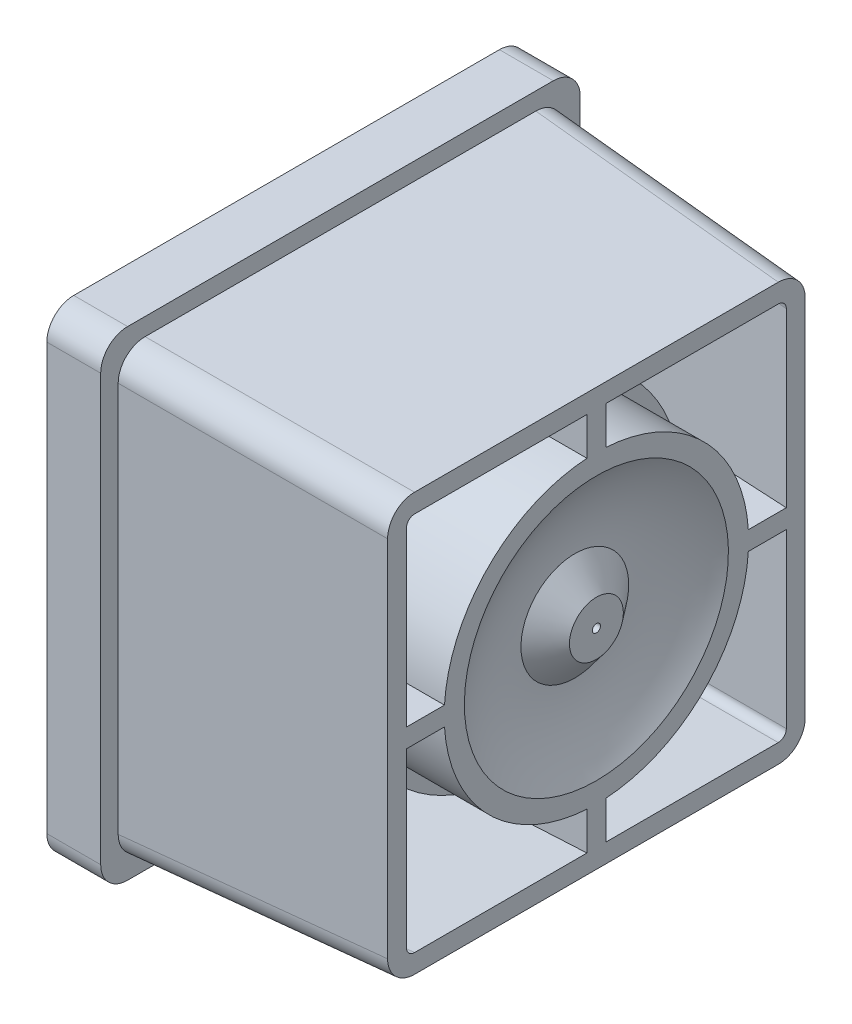
from build123d import *

# Parameters (mm, degrees)
FILLET1_R           = 1
SHELL1_T            = -0.7
SKETCH3_W           = 17.8
SKETCH3_H           = 17.8
BOSS_EXTRUDE1_DEPTH = 2
FILLET2_R           = 1
BOSS_EXTRUDE2_REACH = 17.769
FILLET3_R           = 0.5
SKETCH7_R           = 0.75
SKETCH7_R_2         = 0.5
CUT_EXTRUDE1_DEPTH  = 0.5


with BuildPart() as part:
    # Sketch2 → Loft1 section 0
    with BuildSketch(Plane(origin=(9.5, 0, 0), x_dir=(0, 0, -1), z_dir=(1, 0, 0))):
        with BuildLine():
            Line((7.75, -7.75), (-7.75, -7.75))
            Line((-7.75, -7.75), (-7.75, 7.75))
            Line((-7.75, 7.75), (7.75, 7.75))
            Line((7.75, 7.75), (7.75, -7.75))
        make_face()
    # Sketch1 → Loft1 section 1
    with BuildSketch(Plane(origin=(0, 0, 0), x_dir=(0, 0, -1), z_dir=(1, 0, 0))):
        with BuildLine():
            Line((8.25, -8.25), (-8.25, -8.25))
            Line((-8.25, -8.25), (-8.25, 8.25))
            Line((-8.25, 8.25), (8.25, 8.25))
            Line((8.25, 8.25), (8.25, -8.25))
        make_face()
    loft()

    # Fillet1
    fillet1_edges = [part.edges().sort_by_distance(p)[0] for p in [
        (4.75, -8, -8),
        (4.75, -8, 8),
        (4.75, 8, -8),
        (4.75, 8, 8),
    ]]
    fillet(fillet1_edges, radius=FILLET1_R)

    # Shell1
    shell1_openings = [part.faces().sort_by_distance(p)[0] for p in [
        (0, 0, 0),
        (9.5, 0, 0),
    ]]
    offset(amount=SHELL1_T, openings=shell1_openings)

    # Sketch3 → Boss-Extrude1 (add)
    with BuildSketch(Plane(origin=(0, 0, 0), x_dir=(0, 0, -1), z_dir=(1, 0, 0))):
        Rectangle(SKETCH3_W, SKETCH3_H)
    extrude(amount=-BOSS_EXTRUDE1_DEPTH)

    # Fillet2
    fillet2_edges = [part.edges().sort_by_distance(p)[0] for p in [
        (-1, 8.9, -8.9),
        (-1, -8.9, -8.9),
        (-1, -8.9, 8.9),
        (-1, 8.9, 8.9),
    ]]
    fillet(fillet2_edges, radius=FILLET2_R)

    # Sketch5 → Revolve1 (revolve)
    with BuildSketch(Plane.XY, mode=Mode.PRIVATE) as revolve1_sk:
        with BuildLine():
            Line((0, 0), (0, 6.15))
            Line((0, 6.15), (6.5, 6.15))
            Line((6.5, 6.15), (6.5, 5.65))
            Line((6.5, 5.65), (9.5, 5.65))
            Line((9.5, 5.65), (9.5, 4.9))
            ThreePointArc((9.5, 4.9), (8.903666753, 3.504160896), (8.7, 2))
            Line((8.7, 2), (9.5, 1))
            Line((9.5, 1), (9.5, 0))
            Line((9.5, 0), (0, 0))
        make_face()
    revolve(revolve1_sk.sketch.rotate(Axis((0, 0, 0), (1, 0, 0)), 180), axis=Axis((0, 0, 0), (1, 0, 0)))

    # Boss-Extrude2: up to this face of the body (flat: up to its plane)
    boss_extrude2_end = Plane(part.part.faces().sort_by_distance((9.5, 0, 0))[0])
    # Sketch10 → Boss-Extrude2 (add, up to the picked face)
    with BuildSketch(Plane(origin=(0, 0, 0), x_dir=(0, 0, -1), z_dir=(1, 0, 0)), mode=Mode.PRIVATE) as boss_extrude2_sk1:
        with BuildLine():
            Line((-0.35, 7.549031141), (-0.35, 6.140032573))
            ThreePointArc((-0.35, 6.140032573), (0, 6.15), (0.35, 6.140032573))
            Line((0.35, 6.140032573), (0.35, 7.549031141))
            Line((0.35, 7.549031141), (-0.35, 7.549031141))
        make_face()
    boss_extrude2_tool1 = split(extrude(boss_extrude2_sk1.sketch, amount=BOSS_EXTRUDE2_REACH, mode=Mode.PRIVATE), bisect_by=boss_extrude2_end, keep=Keep.BOTH, mode=Mode.PRIVATE)
    # Sketch10 → Boss-Extrude2 (add, up to the picked face)
    with BuildSketch(Plane(origin=(0, 0, 0), x_dir=(0, 0, -1), z_dir=(1, 0, 0)), mode=Mode.PRIVATE) as boss_extrude2_sk2:
        with BuildLine():
            ThreePointArc((0.35, 6.140032573), (0, 6.15), (-0.35, 6.140032573))
            Line((-0.35, 6.140032573), (-0.35, 5.639148872))
            ThreePointArc((-0.35, 5.639148872), (0, 5.65), (0.35, 5.639148872))
            Line((0.35, 5.639148872), (0.35, 6.140032573))
        make_face()
    boss_extrude2_tool2 = split(extrude(boss_extrude2_sk2.sketch, amount=BOSS_EXTRUDE2_REACH, mode=Mode.PRIVATE), bisect_by=boss_extrude2_end, keep=Keep.BOTH, mode=Mode.PRIVATE)
    # Sketch10 → Boss-Extrude2 (add, up to the picked face)
    with BuildSketch(Plane(origin=(0, 0, 0), x_dir=(0, 0, -1), z_dir=(1, 0, 0)), mode=Mode.PRIVATE) as boss_extrude2_sk3:
        with BuildLine():
            Line((-0.35, -5.639148872), (-0.35, -6.140032573))
            ThreePointArc((-0.35, -6.140032573), (0, -6.15), (0.35, -6.140032573))
            Line((0.35, -6.140032573), (0.35, -5.639148872))
            ThreePointArc((0.35, -5.639148872), (0, -5.65), (-0.35, -5.639148872))
        make_face()
    boss_extrude2_tool3 = split(extrude(boss_extrude2_sk3.sketch, amount=BOSS_EXTRUDE2_REACH, mode=Mode.PRIVATE), bisect_by=boss_extrude2_end, keep=Keep.BOTH, mode=Mode.PRIVATE)
    # Sketch10 → Boss-Extrude2 (add, up to the picked face)
    with BuildSketch(Plane(origin=(0, 0, 0), x_dir=(0, 0, -1), z_dir=(1, 0, 0)), mode=Mode.PRIVATE) as boss_extrude2_sk4:
        with BuildLine():
            Line((7.549031141, 0.35), (6.140032573, 0.35))
            ThreePointArc((6.140032573, 0.35), (6.147507638, 0.17507095), (6.15, 0))
            ThreePointArc((6.15, 0), (6.147507638, -0.17507095), (6.140032573, -0.35))
            Line((6.140032573, -0.35), (7.549031141, -0.35))
            Line((7.549031141, -0.35), (7.549031141, 0.35))
        make_face()
    boss_extrude2_tool4 = split(extrude(boss_extrude2_sk4.sketch, amount=BOSS_EXTRUDE2_REACH, mode=Mode.PRIVATE), bisect_by=boss_extrude2_end, keep=Keep.BOTH, mode=Mode.PRIVATE)
    # Sketch10 → Boss-Extrude2 (add, up to the picked face)
    with BuildSketch(Plane(origin=(0, 0, 0), x_dir=(0, 0, -1), z_dir=(1, 0, 0)), mode=Mode.PRIVATE) as boss_extrude2_sk5:
        with BuildLine():
            Line((-5.639148872, 0.35), (-6.140032573, 0.35))
            ThreePointArc((-6.140032573, 0.35), (-6.15, 0), (-6.140032573, -0.35))
            Line((-6.140032573, -0.35), (-5.639148872, -0.35))
            ThreePointArc((-5.639148872, -0.35), (-5.65, 0), (-5.639148872, 0.35))
        make_face()
    boss_extrude2_tool5 = split(extrude(boss_extrude2_sk5.sketch, amount=BOSS_EXTRUDE2_REACH, mode=Mode.PRIVATE), bisect_by=boss_extrude2_end, keep=Keep.BOTH, mode=Mode.PRIVATE)
    # Sketch10 → Boss-Extrude2 (add, up to the picked face)
    with BuildSketch(Plane(origin=(0, 0, 0), x_dir=(0, 0, -1), z_dir=(1, 0, 0)), mode=Mode.PRIVATE) as boss_extrude2_sk6:
        with BuildLine():
            ThreePointArc((6.15, 0), (6.147507638, 0.17507095), (6.140032573, 0.35))
            Line((6.140032573, 0.35), (5.639148872, 0.35))
            ThreePointArc((5.639148872, 0.35), (5.647286566, 0.175084085), (5.65, 0))
            ThreePointArc((5.65, 0), (5.647286566, -0.175084085), (5.639148872, -0.35))
            Line((5.639148872, -0.35), (6.140032573, -0.35))
            ThreePointArc((6.140032573, -0.35), (6.147507638, -0.17507095), (6.15, 0))
        make_face()
    boss_extrude2_tool6 = split(extrude(boss_extrude2_sk6.sketch, amount=BOSS_EXTRUDE2_REACH, mode=Mode.PRIVATE), bisect_by=boss_extrude2_end, keep=Keep.BOTH, mode=Mode.PRIVATE)
    # Sketch10 → Boss-Extrude2 (add, up to the picked face)
    with BuildSketch(Plane(origin=(0, 0, 0), x_dir=(0, 0, -1), z_dir=(1, 0, 0)), mode=Mode.PRIVATE) as boss_extrude2_sk7:
        with BuildLine():
            ThreePointArc((0.35, -6.140032573), (0, -6.15), (-0.35, -6.140032573))
            Line((-0.35, -6.140032573), (-0.35, -7.549031141))
            Line((-0.35, -7.549031141), (0.35, -7.549031141))
            Line((0.35, -7.549031141), (0.35, -6.140032573))
        make_face()
    boss_extrude2_tool7 = split(extrude(boss_extrude2_sk7.sketch, amount=BOSS_EXTRUDE2_REACH, mode=Mode.PRIVATE), bisect_by=boss_extrude2_end, keep=Keep.BOTH, mode=Mode.PRIVATE)
    # Sketch10 → Boss-Extrude2 (add, up to the picked face)
    with BuildSketch(Plane(origin=(0, 0, 0), x_dir=(0, 0, -1), z_dir=(1, 0, 0)), mode=Mode.PRIVATE) as boss_extrude2_sk8:
        with BuildLine():
            ThreePointArc((0.35, 6.140032573), (0, 6.15), (-0.35, 6.140032573))
            Line((-0.35, 6.140032573), (-0.35, 5.639148872))
            ThreePointArc((-0.35, 5.639148872), (0, 5.65), (0.35, 5.639148872))
            Line((0.35, 5.639148872), (0.35, 6.140032573))
        make_face()
    boss_extrude2_tool8 = split(extrude(boss_extrude2_sk8.sketch, amount=BOSS_EXTRUDE2_REACH, mode=Mode.PRIVATE), bisect_by=boss_extrude2_end, keep=Keep.BOTH, mode=Mode.PRIVATE)
    # Sketch10 → Boss-Extrude2 (add, up to the picked face)
    with BuildSketch(Plane(origin=(0, 0, 0), x_dir=(0, 0, -1), z_dir=(1, 0, 0)), mode=Mode.PRIVATE) as boss_extrude2_sk9:
        with BuildLine():
            Line((-0.35, -5.639148872), (-0.35, -6.140032573))
            ThreePointArc((-0.35, -6.140032573), (0, -6.15), (0.35, -6.140032573))
            Line((0.35, -6.140032573), (0.35, -5.639148872))
            ThreePointArc((0.35, -5.639148872), (0, -5.65), (-0.35, -5.639148872))
        make_face()
    boss_extrude2_tool9 = split(extrude(boss_extrude2_sk9.sketch, amount=BOSS_EXTRUDE2_REACH, mode=Mode.PRIVATE), bisect_by=boss_extrude2_end, keep=Keep.BOTH, mode=Mode.PRIVATE)
    # Sketch10 → Boss-Extrude2 (add, up to the picked face)
    with BuildSketch(Plane(origin=(0, 0, 0), x_dir=(0, 0, -1), z_dir=(1, 0, 0)), mode=Mode.PRIVATE) as boss_extrude2_sk10:
        with BuildLine():
            Line((-6.140032573, 0.35), (-7.549031141, 0.35))
            Line((-7.549031141, 0.35), (-7.549031141, -0.35))
            Line((-7.549031141, -0.35), (-6.140032573, -0.35))
            ThreePointArc((-6.140032573, -0.35), (-6.15, 0), (-6.140032573, 0.35))
        make_face()
    boss_extrude2_tool10 = split(extrude(boss_extrude2_sk10.sketch, amount=BOSS_EXTRUDE2_REACH, mode=Mode.PRIVATE), bisect_by=boss_extrude2_end, keep=Keep.BOTH, mode=Mode.PRIVATE)
    # Sketch10 → Boss-Extrude2 (add, up to the picked face)
    with BuildSketch(Plane(origin=(0, 0, 0), x_dir=(0, 0, -1), z_dir=(1, 0, 0)), mode=Mode.PRIVATE) as boss_extrude2_sk11:
        with BuildLine():
            Line((-5.639148872, 0.35), (-6.140032573, 0.35))
            ThreePointArc((-6.140032573, 0.35), (-6.15, 0), (-6.140032573, -0.35))
            Line((-6.140032573, -0.35), (-5.639148872, -0.35))
            ThreePointArc((-5.639148872, -0.35), (-5.65, 0), (-5.639148872, 0.35))
        make_face()
    boss_extrude2_tool11 = split(extrude(boss_extrude2_sk11.sketch, amount=BOSS_EXTRUDE2_REACH, mode=Mode.PRIVATE), bisect_by=boss_extrude2_end, keep=Keep.BOTH, mode=Mode.PRIVATE)
    # Sketch10 → Boss-Extrude2 (add, up to the picked face)
    with BuildSketch(Plane(origin=(0, 0, 0), x_dir=(0, 0, -1), z_dir=(1, 0, 0)), mode=Mode.PRIVATE) as boss_extrude2_sk12:
        with BuildLine():
            ThreePointArc((6.15, 0), (6.147507638, 0.17507095), (6.140032573, 0.35))
            Line((6.140032573, 0.35), (5.639148872, 0.35))
            ThreePointArc((5.639148872, 0.35), (5.647286566, 0.175084085), (5.65, 0))
            ThreePointArc((5.65, 0), (5.647286566, -0.175084085), (5.639148872, -0.35))
            Line((5.639148872, -0.35), (6.140032573, -0.35))
            ThreePointArc((6.140032573, -0.35), (6.147507638, -0.17507095), (6.15, 0))
        make_face()
    boss_extrude2_tool12 = split(extrude(boss_extrude2_sk12.sketch, amount=BOSS_EXTRUDE2_REACH, mode=Mode.PRIVATE), bisect_by=boss_extrude2_end, keep=Keep.BOTH, mode=Mode.PRIVATE)
    add(boss_extrude2_tool1.solids().sort_by(Axis((0, 6.847852, 0), (1, 0, 0)))[0])
    add(boss_extrude2_tool2.solids().sort_by(Axis((0, 5.89653, 0), (1, 0, 0)))[0])
    add(boss_extrude2_tool3.solids().sort_by(Axis((0, -5.89653, 0), (1, 0, 0)))[0])
    add(boss_extrude2_tool4.solids().sort_by(Axis((0, 0, -6.847852), (1, 0, 0)))[0])
    add(boss_extrude2_tool5.solids().sort_by(Axis((0, 0, 5.89653), (1, 0, 0)))[0])
    add(boss_extrude2_tool6.solids().sort_by(Axis((0, 0, -5.89653), (1, 0, 0)))[0])
    add(boss_extrude2_tool7.solids().sort_by(Axis((0, -6.847852, 0), (1, 0, 0)))[0])
    add(boss_extrude2_tool8.solids().sort_by(Axis((0, 5.89653, 0), (1, 0, 0)))[0])
    add(boss_extrude2_tool9.solids().sort_by(Axis((0, -5.89653, 0), (1, 0, 0)))[0])
    add(boss_extrude2_tool10.solids().sort_by(Axis((0, 0, 6.847852), (1, 0, 0)))[0])
    add(boss_extrude2_tool11.solids().sort_by(Axis((0, 0, 5.89653), (1, 0, 0)))[0])
    add(boss_extrude2_tool12.solids().sort_by(Axis((0, 0, -5.89653), (1, 0, 0)))[0])

    # Sketch6 → Cut-Revolve1 (revolve, cut)
    with BuildSketch(Plane.XY, mode=Mode.PRIVATE) as cut_revolve1_sk:
        Polygon((-2, 5.4), (-0.2, 5.4), (0.002072594, 5.75), (0.502072594, 5.75), (2.150559046, 5.15), (7.8, 5.15), (7.8, 4.2), (4.2, 4.2), (4.2, 3.2), (7.8, 3.2), (7.8, 0), (-2, 0), align=None)
    revolve(cut_revolve1_sk.sketch.rotate(Axis((-2, 0, 0), (1, 0, 0)), 180), axis=Axis((-2, 0, 0), (1, 0, 0)), mode=Mode.SUBTRACT)

    # Fillet3
    fillet3_edges = [part.edges().sort_by_distance(p)[0] for p in [
        (4.2, 3.2, 0),
    ]]
    fillet(fillet3_edges, radius=FILLET3_R)

    # Sketch7 → Cut-Extrude1 (cut)
    with BuildSketch(Plane.ZY.offset(-7.8)):
        with BuildLine():
            Line((0.75, 2.5), (-0.75, 2.5))
            Line((-0.75, 2.5), (-0.75, 0))
            ThreePointArc((-0.75, 0), (0, 0.75), (0.75, 0))
            Line((0.75, 0), (0.75, 2.5))
        make_face()
        Circle(SKETCH7_R)
        with BuildLine():
            ThreePointArc((-0.333292641, -0.671875), (-0.637365468, -0.395304009), (-0.75, 0))
            Line((-0.75, 0), (-0.75, -1.75))
            ThreePointArc((-0.75, -1.75), (-0.530330086, -2.280330086), (0, -2.5))
            ThreePointArc((0, -2.5), (-0.35630482, -1.64921962), (0.499938961, -1.9921875))
            ThreePointArc((0.499938961, -1.9921875), (0.268637296, -1.215081971), (-0.333292641, -0.671875))
        make_face()
        with Locations((0, -2)):
            Circle(SKETCH7_R_2)
    extrude(amount=-CUT_EXTRUDE1_DEPTH, mode=Mode.SUBTRACT)

    # Sketch8 → Cut-Revolve2 (revolve, cut)
    with BuildSketch(Plane.XY, mode=Mode.PRIVATE) as cut_revolve2_sk:
        Polygon((9.5, 0), (8.3, 0), (7.436616889, 0), (7.436616889, 0.75), (8.3, 0.75), (8.646410162, 0.15), (9.5, 0.15), align=None)
    revolve(cut_revolve2_sk.sketch.rotate(Axis((9.5, 0, 0), (-1, 0, 0)), 153.615670251), axis=Axis((9.5, 0, 0), (-1, 0, 0)), mode=Mode.SUBTRACT)


solid = part.part
